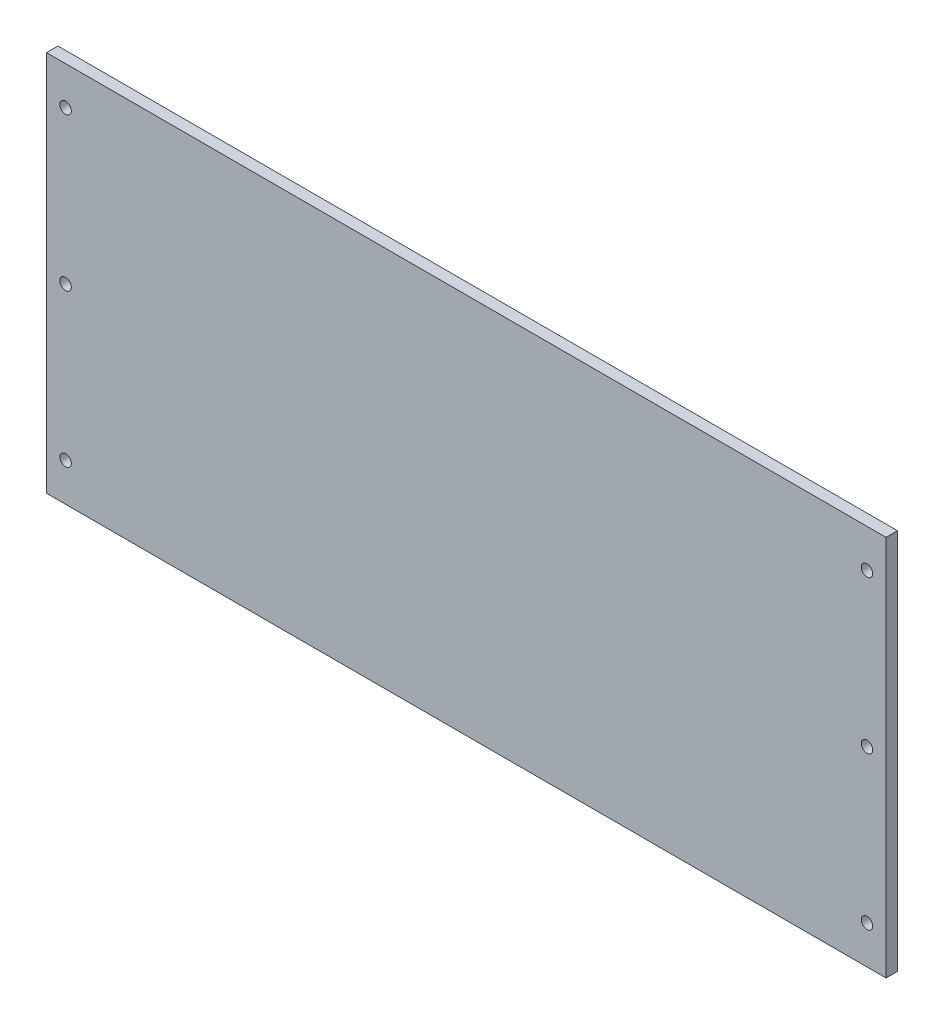
from build123d import *

# Parameters (mm, degrees)
ESQUISSE1_W        = 220
ESQUISSE1_H        = 100
ESQUISSE1_R        = 1.5
BOSS_EXTRU_1_DEPTH = 3


with BuildPart() as part:
    # Esquisse1 → Boss.-Extru.1 (new body)
    with BuildSketch(Plane.XY):
        Rectangle(ESQUISSE1_W, ESQUISSE1_H)
        with Locations((-105, -40)):
            Circle(ESQUISSE1_R, mode=Mode.SUBTRACT)
        with Locations((-105, 0)):
            Circle(ESQUISSE1_R, mode=Mode.SUBTRACT)
        with Locations((-105, 40)):
            Circle(ESQUISSE1_R, mode=Mode.SUBTRACT)
        with Locations(Location((105, 40, 0), (0, 0, 180))):
            Circle(ESQUISSE1_R, mode=Mode.SUBTRACT)
        with Locations(Location((105, 0, 0), (0, 0, 180))):
            Circle(ESQUISSE1_R, mode=Mode.SUBTRACT)
        with Locations(Location((105, -40, 0), (0, 0, 180))):
            Circle(ESQUISSE1_R, mode=Mode.SUBTRACT)
    extrude(amount=BOSS_EXTRU_1_DEPTH)


solid = part.part
